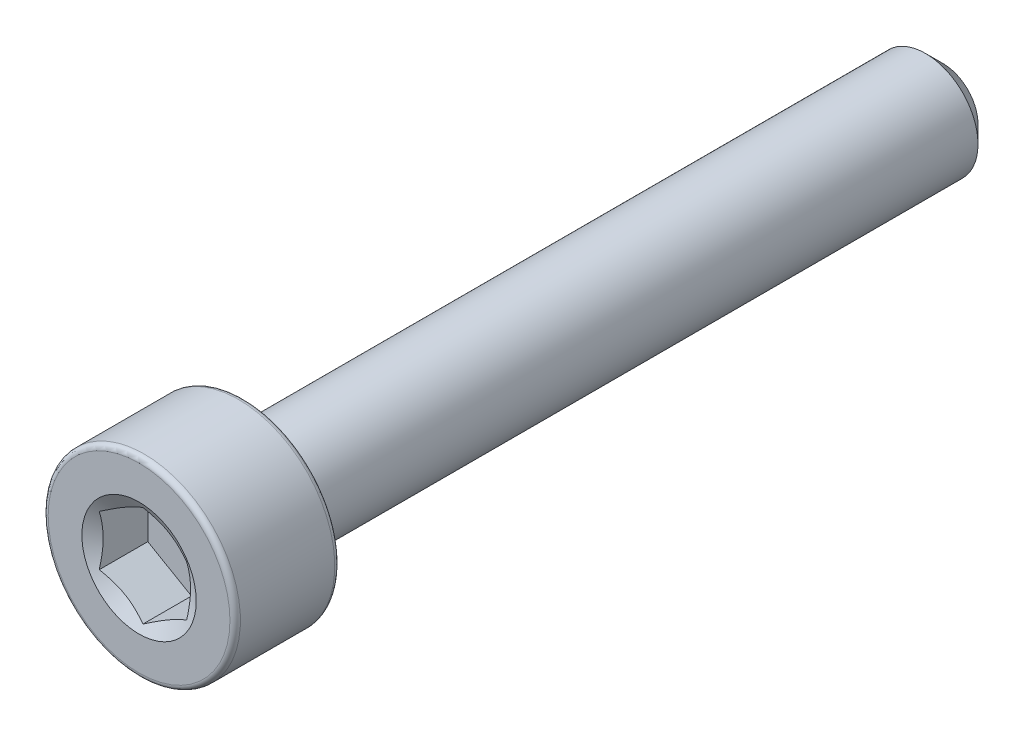
from build123d import *

# Parameters (mm, degrees)
CUT_EXTRUDE1_START = 11.5
CUT_EXTRUDE1_DEPTH = 1.5


with BuildPart() as part:
    # Sketch2 → Revolve1 (revolve)
    with BuildSketch(Plane(origin=(0, 0, 0), x_dir=(0, 0, -1), z_dir=(1, 0, 0)), mode=Mode.PRIVATE) as revolve1_sk:
        with BuildLine():
            Line((11.5, 0), (11.5, 1))
            Line((11.5, 1), (11, 1.5))
            Line((11, 1.5), (-8.5, 1.5))
            Line((-8.5, 1.5), (-8.5, 2.6))
            ThreePointArc((-8.5, 2.6), (-8.543933983, 2.706066017), (-8.65, 2.75))
            Line((-8.65, 2.75), (-11.35, 2.75))
            ThreePointArc((-11.35, 2.75), (-11.456066017, 2.706066017), (-11.5, 2.6))
            Line((-11.5, 2.6), (-11.5, 0))
            Line((-11.5, 0), (11.5, 0))
        make_face()
    revolve(revolve1_sk.sketch.rotate(Axis((0, 0, -11.5), (0, 0, 1)), 90), axis=Axis((0, 0, -11.5), (0, 0, 1)))

    # Sketch3 → Cut-Extrude1 (cut)
    with BuildSketch(Plane.XY.offset(CUT_EXTRUDE1_START)):
        Polygon((-1.25, 0.721687836), (-1.25, -0.721687836), (0, -1.443375673), (1.25, -0.721687836), (1.25, 0.721687836), (0, 1.443375673), align=None)
    extrude(amount=-CUT_EXTRUDE1_DEPTH, mode=Mode.SUBTRACT)

    # Cut-Extrude2 cone 1 section (through the dimple's axis) → Cut-Extrude2 (revolve, cut)
    with BuildSketch(Plane(origin=(0, 0, 11.5), x_dir=(0, -1, 0), z_dir=(1, 0, 0))):
        Polygon((0, 0), (1.636146394, 0), (0, 0.944629561), align=None)
    revolve(axis=Axis((0, 0, 11.5), (0, 0, -1)), mode=Mode.SUBTRACT)


solid = part.part
